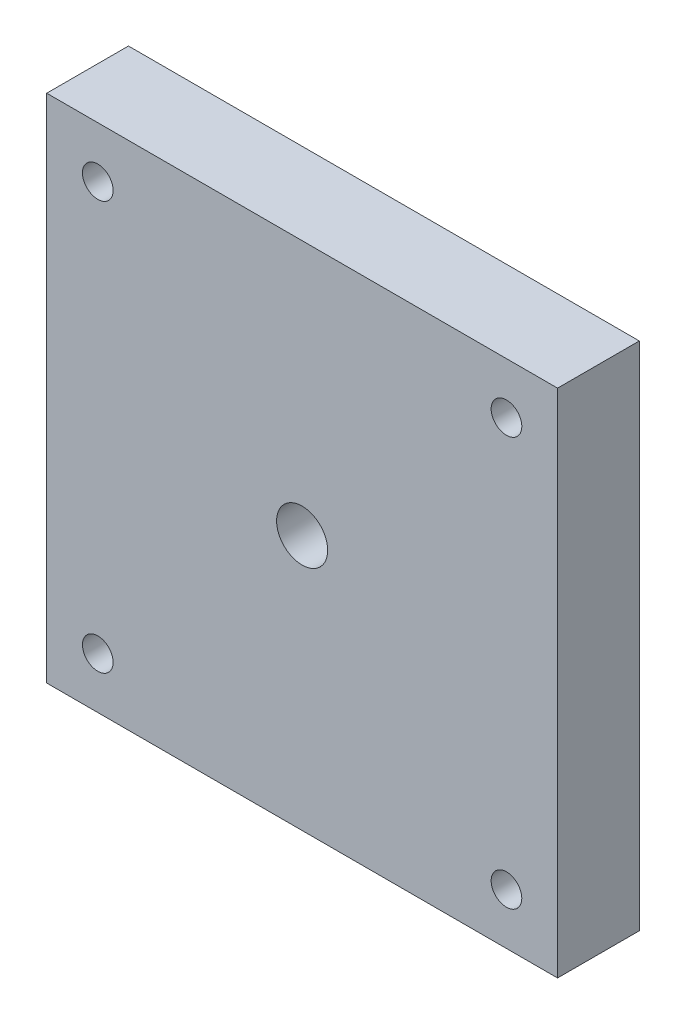
from build123d import *

# Parameters (mm, degrees)
SKETCH_1_W      = 50
SKETCH_1_H      = 50
SKETCH_1_R      = 2.5
SKETCH_1_R_2    = 1.5
EXTRUDE_1_DEPTH = 8


with BuildPart() as part:
    # 草图1 → 凸台-拉伸1 (new body)
    with BuildSketch(Plane.XY):
        Rectangle(SKETCH_1_W, SKETCH_1_H)
        Circle(SKETCH_1_R, mode=Mode.SUBTRACT)
        with Locations((-20, 20)):
            Circle(SKETCH_1_R_2, mode=Mode.SUBTRACT)
        with Locations(Location((20, 20, 0), (0, 0, 180))):
            Circle(SKETCH_1_R_2, mode=Mode.SUBTRACT)
        with Locations((20, -20)):
            Circle(SKETCH_1_R_2, mode=Mode.SUBTRACT)
        with Locations(Location((-20, -20, 0), (0, 0, 180))):
            Circle(SKETCH_1_R_2, mode=Mode.SUBTRACT)
    extrude(amount=EXTRUDE_1_DEPTH)


solid = part.part
